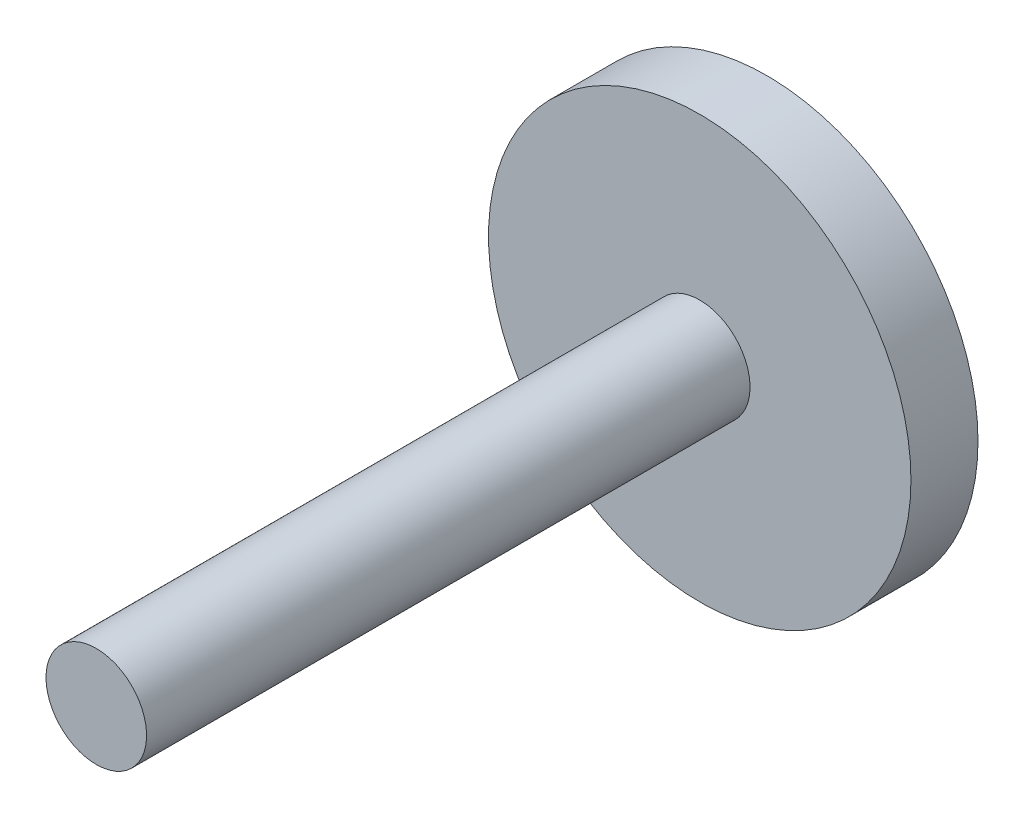
from build123d import *

# Parameters (mm, degrees)
SKETCH1_R           = 31.5
BOSS_EXTRUDE1_DEPTH = 10
SKETCH2_R           = 7.5
BOSS_EXTRUDE2_DEPTH = 100


with BuildPart() as part:
    # Sketch1 → Boss-Extrude1 (new body)
    with BuildSketch(Plane.XY):
        Circle(SKETCH1_R)
    extrude(amount=BOSS_EXTRUDE1_DEPTH)

    # Sketch2 → Boss-Extrude2 (add)
    with BuildSketch(Plane.XY):
        with Locations(Location((0, 0, 0), (0, 0, 180))):
            Circle(SKETCH2_R)
    extrude(amount=BOSS_EXTRUDE2_DEPTH)


solid = part.part
